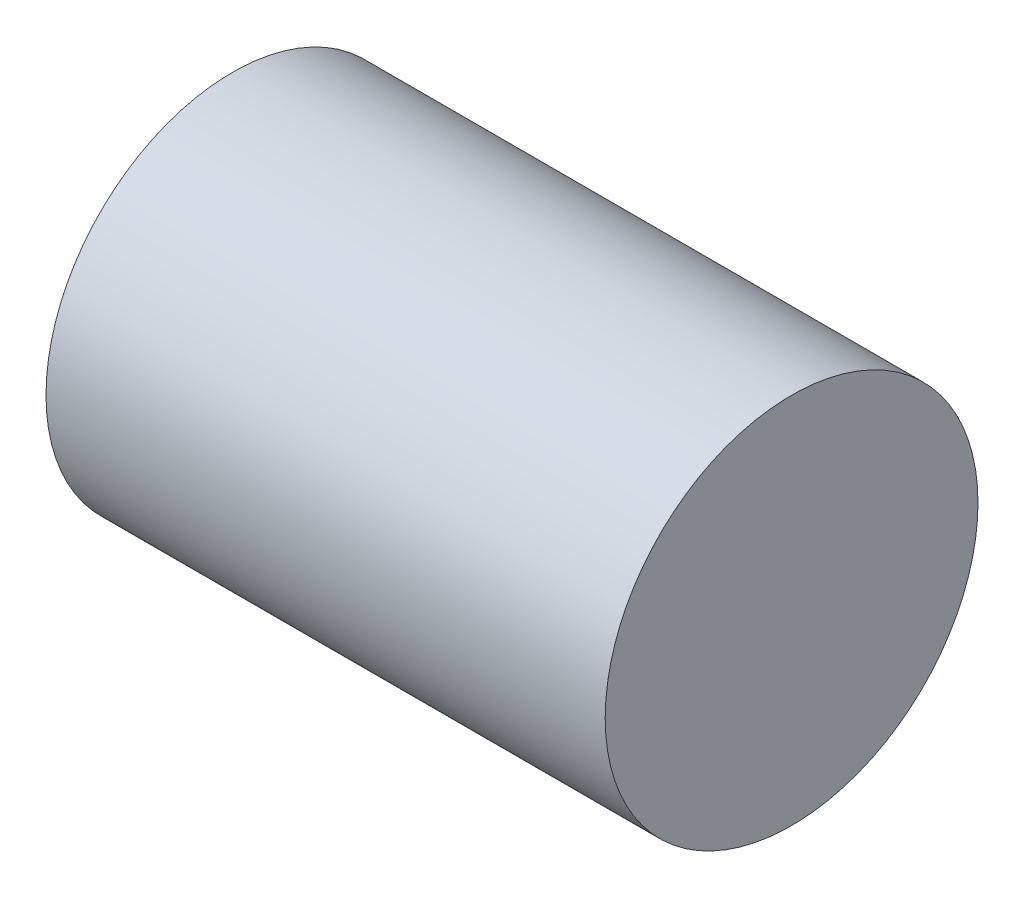
from build123d import *

# Parameters (mm, degrees)
SKETCH1_R           = 12.7
BOSS_EXTRUDE1_DEPTH = 38.1


with BuildPart() as part:
    # Sketch1 → Boss-Extrude1 (new body)
    with BuildSketch(Plane(origin=(0, 0, 0), x_dir=(0, 0, -1), z_dir=(1, 0, 0))):
        with Locations(Location((0, 0, 0), (0, 0, 180))):
            Circle(SKETCH1_R)
    extrude(amount=BOSS_EXTRUDE1_DEPTH)


solid = part.part
